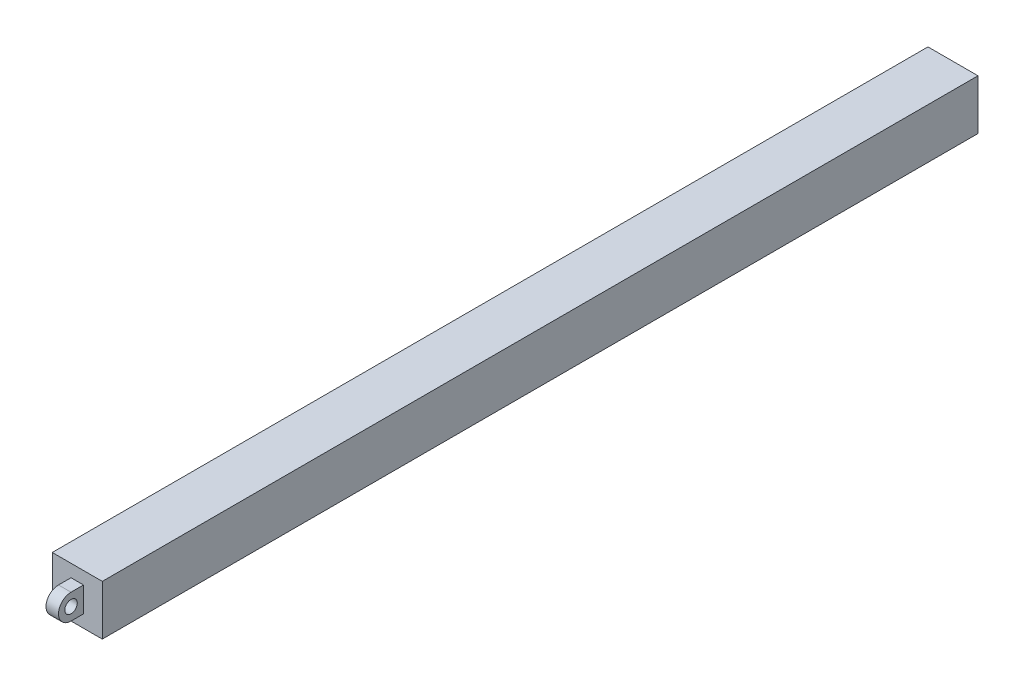
from build123d import *

# Parameters (mm, degrees)
SKETCH_2_W      = 175
SKETCH_2_H      = 10
EXTRUDE_1_DEPTH = 5
SKETCH_3_R      = 1.25
EXTRUDE_2_DEPTH = 1.25


with BuildPart() as part:
    # 스케치2 → 보스-돌출1 (new, symmetric)
    with BuildSketch(Plane(origin=(0, 0, 0), x_dir=(0, 0, -1), z_dir=(1, 0, 0))):
        Rectangle(SKETCH_2_W, SKETCH_2_H)
    extrude(amount=EXTRUDE_1_DEPTH, both=True)

    # 스케치3 → 보스-돌출2 (add, symmetric)
    with BuildSketch(Plane(origin=(0, 0, 0), x_dir=(0, 0, -1), z_dir=(1, 0, 0))):
        with BuildLine():
            Line((-90, 2.5), (-87.5, 2.5))
            Line((-87.5, 2.5), (-87.5, -2.5))
            Line((-87.5, -2.5), (-90, -2.5))
            ThreePointArc((-90, -2.5), (-92.5, 0), (-90, 2.5))
        make_face()
        with Locations((-90, 0)):
            Circle(SKETCH_3_R, mode=Mode.SUBTRACT)
    extrude(amount=EXTRUDE_2_DEPTH, both=True)


solid = part.part
